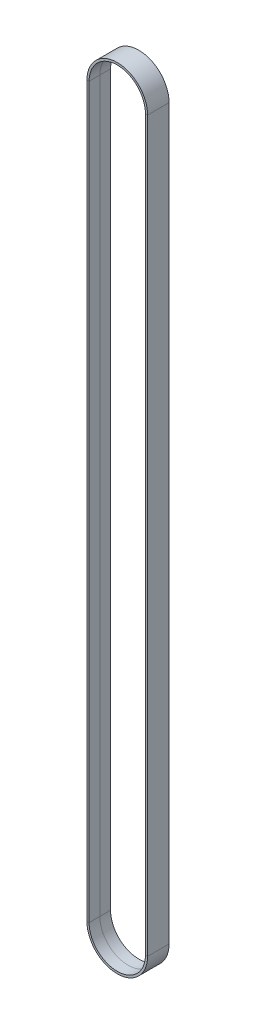
from build123d import *


with BuildPart() as part:
    # По траектории1: sweep along a path in Эскиз3
    with BuildLine(Plane.XY) as sweep_1_path:
        Line((-26.25, -678.678709755), (-26.25, 0))
        ThreePointArc((-26.25, 0), (0, 26.25), (26.25, 0))
        Line((26.25, 0), (26.25, -678.678709755))
        ThreePointArc((26.25, -678.678709755), (0, -704.928709755), (-26.25, -678.678709755))
    # Эскиз4 → По траектории1 (sweep)
    with BuildSketch(Plane(origin=(0, 0, 0), x_dir=(1, 0, 0), z_dir=(0, 1, 0))):
        Polygon((-26.25, 0), (-26.25, -10), (-28.25, -10), (-28.25, 10), (-26.25, 10), align=None)
    sweep(path=sweep_1_path.line)


solid = part.part
